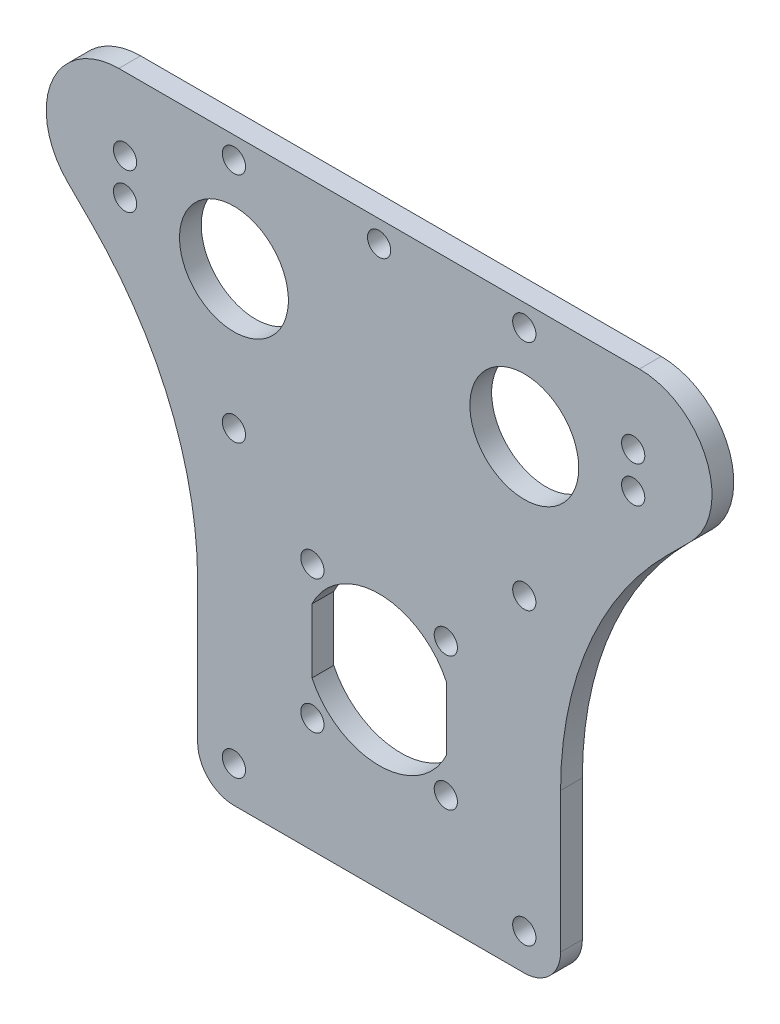
from build123d import *

# Parameters (mm, degrees)
SKETCH_1_W          = 50
SKETCH_1_H          = 50
SKETCH_1_R          = 1.6
EXTRUDE_1_DEPTH     = 3
FILLET_1_R          = 5
CUT_EXTRUDE_1_DEPTH = 36.482389998
EXTRUDE_2_DEPTH     = 3
FILLET_2_R          = 50
SKETCH_4_R          = 1.6
CUT_EXTRUDE_2_DEPTH = 72.672475366
SKETCH_5_R          = 7.5
CUT_EXTRUDE_3_DEPTH = 72.672475366
SKETCH_6_R          = 1.6
CUT_EXTRUDE_4_DEPTH = 72.672475366
SKETCH_7_R          = 1.6
CUT_EXTRUDE_5_DEPTH = 72.672475366


with BuildPart() as part:
    # ｽｹｯﾁ1 → ﾎﾞｽ - 押し出し1 (new body)
    with BuildSketch(Plane.XY):
        Rectangle(SKETCH_1_W, SKETCH_1_H)
        with Locations((-20, 20)):
            Circle(SKETCH_1_R, mode=Mode.SUBTRACT)
        with Locations((-9.192388155, 9.192388155)):
            Circle(SKETCH_1_R, mode=Mode.SUBTRACT)
        with Locations((9.192388155, 9.192388155)):
            Circle(SKETCH_1_R, mode=Mode.SUBTRACT)
        with Locations((20, 20)):
            Circle(SKETCH_1_R, mode=Mode.SUBTRACT)
        with Locations((9.192388155, -9.192388155)):
            Circle(SKETCH_1_R, mode=Mode.SUBTRACT)
        with Locations((20, -20)):
            Circle(SKETCH_1_R, mode=Mode.SUBTRACT)
        with Locations((-9.192388155, -9.192388155)):
            Circle(SKETCH_1_R, mode=Mode.SUBTRACT)
        with Locations((-20, -20)):
            Circle(SKETCH_1_R, mode=Mode.SUBTRACT)
    extrude(amount=EXTRUDE_1_DEPTH)

    # ﾌｨﾚｯﾄ1
    fillet_1_edges = [part.edges().sort_by_distance(p)[0] for p in [
        (25, -25, 1.5),
        (-25, -25, 1.5),
        (-25, 25, 1.5),
        (25, 25, 1.5),
    ]]
    fillet(fillet_1_edges, radius=FILLET_1_R)

    # ｽｹｯﾁ2 → ｶｯﾄ - 押し出し1 (cut, through all)
    with BuildSketch(Plane.XY.offset(3)):
        with BuildLine():
            Line((-9.25, 4.415880433), (-9.25, -4.415880433))
            ThreePointArc((-9.25, -4.415880433), (0, -10.25), (9.25, -4.415880433))
            Line((9.25, -4.415880433), (9.25, 4.415880433))
            ThreePointArc((9.25, 4.415880433), (0, 10.25), (-9.25, 4.415880433))
        make_face()
    extrude(amount=-CUT_EXTRUDE_1_DEPTH, mode=Mode.SUBTRACT)

    # ｽｹｯﾁ3 → ﾎﾞｽ - 押し出し2 (add, through all)
    with BuildSketch(Plane.XY.offset(3)):
        with BuildLine():
            Line((-25, 20), (-42.928932188, 37.928932188))
            ThreePointArc((-42.928932188, 37.928932188), (-45.096659701, 48.826834324), (-35.857864376, 55))
            Line((-35.857864376, 55), (35.857864376, 55))
            ThreePointArc((35.857864376, 55), (45.096659701, 48.826834324), (42.928932188, 37.928932188))
            Line((42.928932188, 37.928932188), (25, 20))
            ThreePointArc((25, 20), (23.535533906, 23.535533906), (20, 25))
            Line((20, 25), (-20, 25))
            ThreePointArc((-20, 25), (-23.535533906, 23.535533906), (-25, 20))
        make_face()
    extrude(amount=-EXTRUDE_2_DEPTH)

    # ﾌｨﾚｯﾄ2
    fillet_2_edges = [part.edges().sort_by_distance(p)[0] for p in [
        (25, 20, 1.5),
        (-25, 20, 1.5),
    ]]
    fillet(fillet_2_edges, radius=FILLET_2_R)

    # ｽｹｯﾁ4 → ｶｯﾄ - 押し出し2 (cut, through all)
    with BuildSketch(Plane.XY.offset(3)):
        with Locations((-35, 45)):
            Circle(SKETCH_4_R)
        with Locations(Location((35, 45, 0), (0, 0, 180))):
            Circle(SKETCH_4_R)
    extrude(amount=-CUT_EXTRUDE_2_DEPTH, mode=Mode.SUBTRACT)

    # ｽｹｯﾁ5 → ｶｯﾄ - 押し出し3 (cut, through all)
    with BuildSketch(Plane.XY.offset(3)):
        with Locations((20, 39)):
            Circle(SKETCH_5_R)
        with Locations(Location((-20, 39, 0), (0, 0, 180))):
            Circle(SKETCH_5_R)
    extrude(amount=-CUT_EXTRUDE_3_DEPTH, mode=Mode.SUBTRACT)

    # ｽｹｯﾁ6 → ｶｯﾄ - 押し出し4 (cut, through all)
    with BuildSketch(Plane(origin=(0, 0, 0), x_dir=(-1, 0, 0), z_dir=(0, 0, -1))):
        with Locations((-35, 40)):
            Circle(SKETCH_6_R)
        with Locations(Location((35, 40, 0), (0, 0, 180))):
            Circle(SKETCH_6_R)
    extrude(amount=-CUT_EXTRUDE_4_DEPTH, mode=Mode.SUBTRACT)

    # ｽｹｯﾁ7 → ｶｯﾄ - 押し出し5 (cut, through all)
    with BuildSketch(Plane.XY.offset(3)):
        with Locations((0, 52)):
            Circle(SKETCH_7_R)
        with Locations((20, 52)):
            Circle(SKETCH_7_R)
        with Locations((-20, 52)):
            Circle(SKETCH_7_R)
    extrude(amount=-CUT_EXTRUDE_5_DEPTH, mode=Mode.SUBTRACT)


solid = part.part
